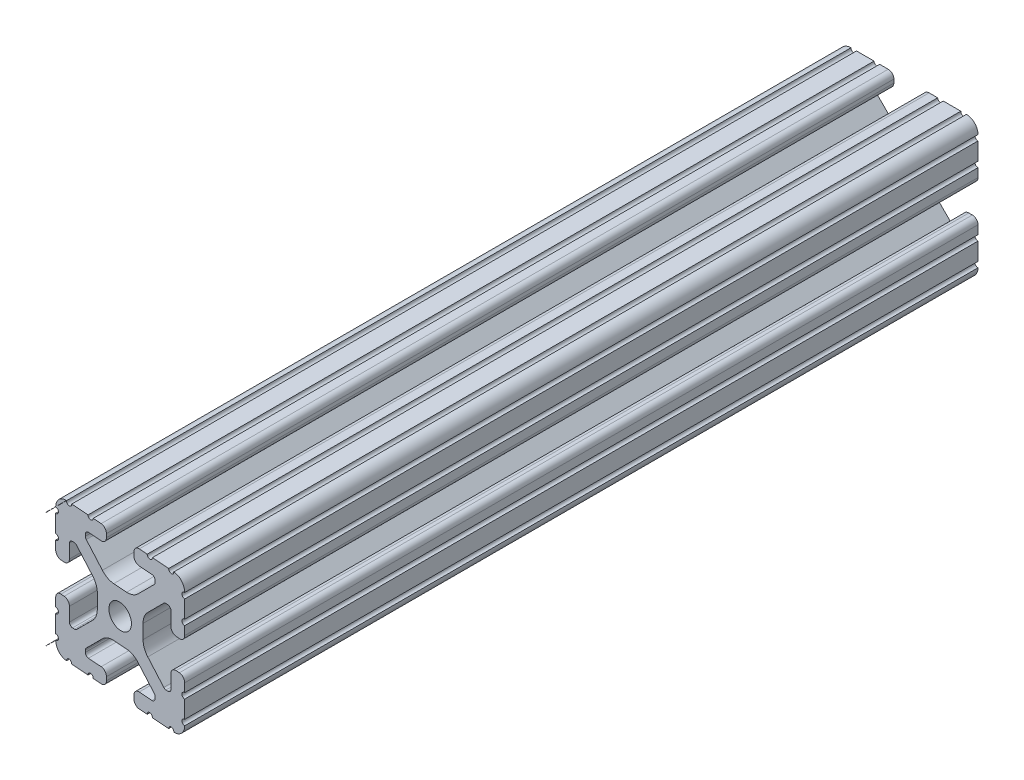
from build123d import *

# Parameters (mm, degrees)
SKETCH1_R          = 3.3274
EXTRUDE1_DEPTH     = 217.932
CUT_EXTRUDE1_DEPTH = 127


with BuildPart() as part:
    # Sketch1 → Extrude1 (new body)
    with BuildSketch(Plane.XY):
        with BuildLine():
            Line((-10.022898969, 12.91475973), (-5.252158105, 8.144007132))
            ThreePointArc((-5.252158105, 8.144007132), (-3.715177372, 7.117027388), (-1.902183975, 6.7564))
            Line((-1.902183975, 6.7564), (1.902183975, 6.7564))
            ThreePointArc((1.902183975, 6.7564), (3.715177372, 7.117027388), (5.252158105, 8.144007132))
            Line((5.252158105, 8.144007132), (10.022898969, 12.91475973))
            ThreePointArc((10.022898969, 12.91475973), (10.218362387, 13.207291992), (10.287, 13.552357131))
            Line((10.287, 13.552357131), (10.287, 14.0843))
            ThreePointArc((10.287, 14.0843), (10.022898185, 14.721898185), (9.3853, 14.986))
            Line((9.3853, 14.986), (5.617617549, 14.986))
            ThreePointArc((5.617617549, 14.986), (4.519044045, 15.441044045), (4.064, 16.539617549))
            Line((4.064, 16.539617549), (4.064, 17.496382451))
            ThreePointArc((4.064, 17.496382451), (4.519044045, 18.594955955), (5.617617549, 19.05))
            Line((5.617617549, 19.05), (7.974178704, 19.05))
            ThreePointArc((7.974178704, 19.05), (8.736178704, 18.288), (9.498178704, 19.05))
            Line((9.498178704, 19.05), (14.327719207, 19.05))
            ThreePointArc((14.327719207, 19.05), (15.087603123, 18.231251131), (15.847487039, 19.05))
            ThreePointArc((15.847487039, 19.05), (18.120176289, 18.120192083), (19.05, 15.847509295))
            ThreePointArc((19.05, 15.847509295), (18.231250992, 15.08762539), (19.05, 14.327741484))
            Line((19.05, 14.327741484), (19.05, 9.496091471))
            ThreePointArc((19.05, 9.496091471), (18.231250992, 8.736207565), (19.05, 7.97632366))
            Line((19.05, 7.97632366), (19.05, 5.617617549))
            ThreePointArc((19.05, 5.617617549), (18.594955955, 4.519044045), (17.496382451, 4.064))
            Line((17.496382451, 4.064), (16.539617549, 4.064))
            ThreePointArc((16.539617549, 4.064), (15.441044045, 4.519044045), (14.986, 5.617617549))
            Line((14.986, 5.617617549), (14.986, 9.385342516))
            ThreePointArc((14.986, 9.385342516), (14.721898185, 10.022940701), (14.0843, 10.287042516))
            Line((14.0843, 10.287042516), (13.516042086, 10.287042516))
            ThreePointArc((13.516042086, 10.287042516), (13.170975923, 10.218404478), (12.878443117, 10.022939917))
            Line((12.878443117, 10.022939917), (8.14758008, 5.292065243))
            ThreePointArc((8.14758008, 5.292065243), (7.117955879, 3.751120653), (6.7564, 1.933453584))
            Line((6.7564, 1.933453584), (6.7564, -1.933453584))
            ThreePointArc((6.7564, -1.933453584), (7.117955879, -3.751120653), (8.14758008, -5.292065243))
            Line((8.14758008, -5.292065243), (12.878443117, -10.022939917))
            ThreePointArc((12.878443117, -10.022939917), (13.170975923, -10.218404478), (13.516042086, -10.287042516))
            Line((13.516042086, -10.287042516), (14.0843, -10.287042516))
            ThreePointArc((14.0843, -10.287042516), (14.721898185, -10.022940701), (14.986, -9.385342516))
            Line((14.986, -9.385342516), (14.986, -5.617617549))
            ThreePointArc((14.986, -5.617617549), (15.441044045, -4.519044045), (16.539617549, -4.064))
            Line((16.539617549, -4.064), (17.496382451, -4.064))
            ThreePointArc((17.496382451, -4.064), (18.594955955, -4.519044045), (19.05, -5.617617549))
            Line((19.05, -5.617617549), (19.05, -7.976318491))
            ThreePointArc((19.05, -7.976318491), (18.231250992, -8.736202396), (19.05, -9.496086302))
            Line((19.05, -9.496086302), (19.05, -14.32774291))
            ThreePointArc((19.05, -14.32774291), (18.231250992, -15.087626816), (19.05, -15.847510721))
            ThreePointArc((19.05, -15.847510721), (18.120175716, -18.120192644), (15.847486868, -19.05))
            ThreePointArc((15.847486868, -19.05), (15.087602952, -18.231251131), (14.327719036, -19.05))
            Line((14.327719036, -19.05), (9.496062448, -19.05))
            ThreePointArc((9.496062448, -19.05), (8.736178532, -18.231251131), (7.976294616, -19.05))
            Line((7.976294616, -19.05), (5.617617549, -19.05))
            ThreePointArc((5.617617549, -19.05), (4.519044045, -18.594955955), (4.064, -17.496382451))
            Line((4.064, -17.496382451), (4.064, -16.539617549))
            ThreePointArc((4.064, -16.539617549), (4.519044045, -15.441044045), (5.617617549, -14.986))
            Line((5.617617549, -14.986), (9.3853, -14.986))
            ThreePointArc((9.3853, -14.986), (10.022898185, -14.721898185), (10.287, -14.0843))
            Line((10.287, -14.0843), (10.287, -13.552357131))
            ThreePointArc((10.287, -13.552357131), (10.218362387, -13.207291992), (10.022898969, -12.91475973))
            Line((10.022898969, -12.91475973), (5.252158105, -8.144007132))
            ThreePointArc((5.252158105, -8.144007132), (3.715177372, -7.117027388), (1.902183975, -6.7564))
            Line((1.902183975, -6.7564), (-1.902183975, -6.7564))
            ThreePointArc((-1.902183975, -6.7564), (-3.715177372, -7.117027388), (-5.252158105, -8.144007132))
            Line((-5.252158105, -8.144007132), (-10.022898969, -12.91475973))
            ThreePointArc((-10.022898969, -12.91475973), (-10.218362387, -13.207291992), (-10.287, -13.552357131))
            Line((-10.287, -13.552357131), (-10.287, -14.0843))
            ThreePointArc((-10.287, -14.0843), (-10.022898185, -14.721898185), (-9.3853, -14.986))
            Line((-9.3853, -14.986), (-5.617617549, -14.986))
            ThreePointArc((-5.617617549, -14.986), (-4.519044045, -15.441044045), (-4.064, -16.539617549))
            Line((-4.064, -16.539617549), (-4.064, -17.496382451))
            ThreePointArc((-4.064, -17.496382451), (-4.519044045, -18.594955955), (-5.617617549, -19.05))
            Line((-5.617617549, -19.05), (-7.976294616, -19.05))
            ThreePointArc((-7.976294616, -19.05), (-8.736178532, -18.231251131), (-9.496062448, -19.05))
            Line((-9.496062448, -19.05), (-14.327719036, -19.05))
            ThreePointArc((-14.327719036, -19.05), (-15.087602952, -18.231251131), (-15.847486868, -19.05))
            ThreePointArc((-15.847486868, -19.05), (-18.120175716, -18.120192644), (-19.05, -15.847510721))
            ThreePointArc((-19.05, -15.847510721), (-18.231250992, -15.087626816), (-19.05, -14.32774291))
            Line((-19.05, -14.32774291), (-19.05, -9.496086302))
            ThreePointArc((-19.05, -9.496086302), (-18.231250992, -8.736202396), (-19.05, -7.976318491))
            Line((-19.05, -7.976318491), (-19.05, -5.617617549))
            ThreePointArc((-19.05, -5.617617549), (-18.594955955, -4.519044045), (-17.496382451, -4.064))
            Line((-17.496382451, -4.064), (-16.539617549, -4.064))
            ThreePointArc((-16.539617549, -4.064), (-15.441044045, -4.519044045), (-14.986, -5.617617549))
            Line((-14.986, -5.617617549), (-14.986, -9.385342516))
            ThreePointArc((-14.986, -9.385342516), (-14.721898185, -10.022940701), (-14.0843, -10.287042516))
            Line((-14.0843, -10.287042516), (-13.516042086, -10.287042516))
            ThreePointArc((-13.516042086, -10.287042516), (-13.170975923, -10.218404478), (-12.878443117, -10.022939917))
            Line((-12.878443117, -10.022939917), (-8.14758008, -5.292065243))
            ThreePointArc((-8.14758008, -5.292065243), (-7.117955879, -3.751120653), (-6.7564, -1.933453584))
            Line((-6.7564, -1.933453584), (-6.7564, 1.933453584))
            ThreePointArc((-6.7564, 1.933453584), (-7.117955879, 3.751120653), (-8.14758008, 5.292065243))
            Line((-8.14758008, 5.292065243), (-12.878443117, 10.022939917))
            ThreePointArc((-12.878443117, 10.022939917), (-13.170975923, 10.218404478), (-13.516042086, 10.287042516))
            Line((-13.516042086, 10.287042516), (-14.0843, 10.287042516))
            ThreePointArc((-14.0843, 10.287042516), (-14.721898185, 10.022940701), (-14.986, 9.385342516))
            Line((-14.986, 9.385342516), (-14.986, 5.617617549))
            ThreePointArc((-14.986, 5.617617549), (-15.441044045, 4.519044045), (-16.539617549, 4.064))
            Line((-16.539617549, 4.064), (-17.496382451, 4.064))
            ThreePointArc((-17.496382451, 4.064), (-18.594955955, 4.519044045), (-19.05, 5.617617549))
            Line((-19.05, 5.617617549), (-19.05, 7.97632366))
            ThreePointArc((-19.05, 7.97632366), (-18.231250992, 8.736207565), (-19.05, 9.496091471))
            Line((-19.05, 9.496091471), (-19.05, 14.327741484))
            ThreePointArc((-19.05, 14.327741484), (-18.231250992, 15.08762539), (-19.05, 15.847509295))
            ThreePointArc((-19.05, 15.847509295), (-18.120176289, 18.120192083), (-15.847487039, 19.05))
            ThreePointArc((-15.847487039, 19.05), (-15.087603123, 18.231251131), (-14.327719207, 19.05))
            Line((-14.327719207, 19.05), (-9.498178704, 19.05))
            ThreePointArc((-9.498178704, 19.05), (-8.736178704, 18.288), (-7.974178704, 19.05))
            Line((-7.974178704, 19.05), (-5.617617549, 19.05))
            ThreePointArc((-5.617617549, 19.05), (-4.519044045, 18.594955955), (-4.064, 17.496382451))
            Line((-4.064, 17.496382451), (-4.064, 16.539617549))
            ThreePointArc((-4.064, 16.539617549), (-4.519044045, 15.441044045), (-5.617617549, 14.986))
            Line((-5.617617549, 14.986), (-9.3853, 14.986))
            ThreePointArc((-9.3853, 14.986), (-10.022898185, 14.721898185), (-10.287, 14.0843))
            Line((-10.287, 14.0843), (-10.287, 13.552357131))
            ThreePointArc((-10.287, 13.552357131), (-10.218362387, 13.207291992), (-10.022898969, 12.91475973))
        make_face()
        Circle(SKETCH1_R, mode=Mode.SUBTRACT)
    extrude(amount=-EXTRUDE1_DEPTH)

    # Sketch2 → Cut-Extrude1 (cut)
    with BuildSketch(Plane(origin=(0, 19.05, 0), x_dir=(1, 0, 0), z_dir=(0, 1, 0))):
        Polygon((19.05, 0), (-19.05, 2.664211535), (-19.05, 0), align=None)
    extrude(amount=-CUT_EXTRUDE1_DEPTH, mode=Mode.SUBTRACT)


solid = part.part
